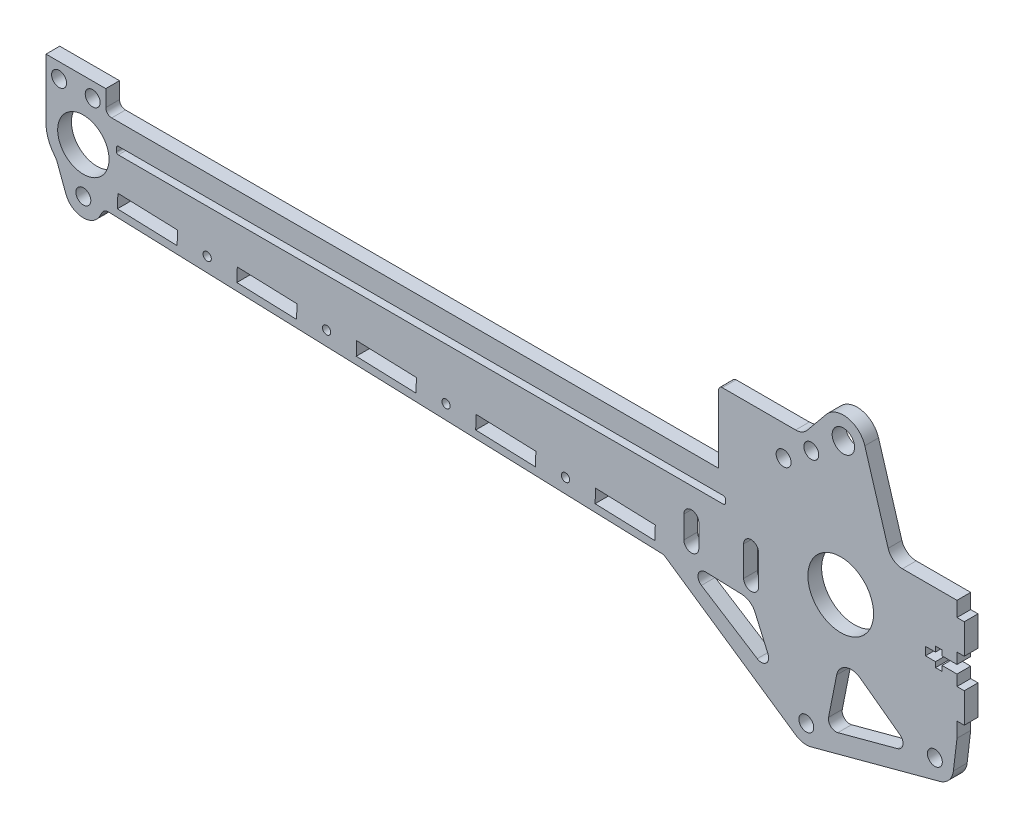
from build123d import *

# Parameters (mm, degrees)
SKETCH1_R            = 10.9125
BOSS_EXTRUDE1_DEPTH  = 5.842
SKETCH2_W            = 293.790339819
SKETCH2_H            = 3.175
CUT_EXTRUDE1_DEPTH   = 183.648332583
FILLET1_R            = 0.79375
SKETCH3_R            = 13.97
CUT_EXTRUDE2_DEPTH   = 183.648332583
SKETCH5_R            = 3.175
BOSS_EXTRUDE3_DEPTH  = 5.842
FILLET2_R            = 2.54
BOSS_EXTRUDE6_START  = -5.842
SKETCH8_R            = 3.175
BOSS_EXTRUDE6_DEPTH  = 5.842
FILLET7_R            = 6.35
BOSS_EXTRUDE8_START  = -5.842
BOSS_EXTRUDE8_DEPTH  = 5.842
FILLET8_R            = 25.4
FILLET9_R            = 3.175
SKETCH11_R           = 3.175
BOSS_EXTRUDE11_DEPTH = 5.842
FILLET10_R           = 6.35
SKETCH13_R           = 1.7526
CUT_EXTRUDE4_DEPTH   = 218.952958723
BOSS_EXTRUDE13_DEPTH = 5.842
FILLET12_R           = 3.175
CUT_EXTRUDE6_DEPTH   = 218.952958723
BOSS_EXTRUDE15_START = -5.842
SKETCH18_R           = 4.7625
BOSS_EXTRUDE15_DEPTH = 5.842
FILLET14_R           = 76.2
BOSS_EXTRUDE17_DEPTH = 5.842
FILLET15_R           = 6.35
SKETCH22_W           = 34.925
SKETCH22_H           = 3.175
BOSS_EXTRUDE19_DEPTH = 5.842
FILLET17_R           = 0.79375
BOSS_EXTRUDE22_START = -5.842
BOSS_EXTRUDE22_DEPTH = 5.842
FILLET21_R           = 1.5875
FILLET22_R           = 6.35
SKETCH27_R           = 3.175
CUT_EXTRUDE8_DEPTH   = 224.524729346


with BuildPart() as part:
    # Sketch1 → Boss-Extrude1 (new body)
    with BuildSketch(Plane.XY):
        with BuildLine():
            Line((122.709551788, -20.986085355), (160.954012843, -20.59834137))
            ThreePointArc((160.954012843, -20.59834137), (181.344310544, 0.104420161), (160.745175204, 20.5994))
            Line((160.745175204, 20.5994), (-161.220164615, 20.5994))
            ThreePointArc((-161.220164615, 20.5994), (-177.092786914, 4.999147791), (-161.769577895, -11.141089909))
            Line((-161.769577895, -11.141089909), (122.425409892, -20.982607653))
            ThreePointArc((122.425409892, -20.982607653), (122.567461384, -20.985936125), (122.709551788, -20.986085355))
        make_face()
        with BuildLine():
            ThreePointArc((119.470175204, -1.936411689), (122.645175204, 1.238588311), (125.820175204, -1.936411689))
            Line((125.820175204, -1.936411689), (125.820175204, -14.636411689))
            ThreePointArc((125.820175204, -14.636411689), (122.645175204, -17.811411689), (119.470175204, -14.636411689))
            Line((119.470175204, -14.636411689), (119.470175204, -1.936411689))
        make_face(mode=Mode.SUBTRACT)
        with Locations((-161.220164615, 4.7244)):
            Circle(SKETCH1_R, mode=Mode.SUBTRACT)
        with Locations((160.745175204, 0)):
            Circle(SKETCH1_R, mode=Mode.SUBTRACT)
    extrude(amount=BOSS_EXTRUDE1_DEPTH)

    # Sketch2 → Cut-Extrude1 (cut, through all)
    with BuildSketch(Plane.XY.offset(5.842)):
        with Locations((-0.237494705, 9.9695)):
            Rectangle(SKETCH2_W, SKETCH2_H)
    extrude(amount=-CUT_EXTRUDE1_DEPTH, mode=Mode.SUBTRACT)

    # Fillet1
    fillet1_edges = [part.edges().sort_by_distance(p)[0] for p in [
        (-147.132664615, 8.382, 2.921),
        (-147.132664615, 11.557, 2.921),
        (146.657675204, 11.557, 2.921),
        (146.657675204, 8.382, 2.921),
    ]]
    fillet(fillet1_edges, radius=FILLET1_R)

    # Sketch3 → Cut-Extrude2 (cut, through all)
    with BuildSketch(Plane.XY.offset(5.842)):
        with Locations((160.745175204, 0)):
            Circle(SKETCH3_R)
    extrude(amount=-CUT_EXTRUDE2_DEPTH, mode=Mode.SUBTRACT)

    # Sketch5 → Boss-Extrude3 (add)
    with BuildSketch(Plane.XY.offset(5.842)):
        Polygon((-177.092786914, 4.999147791), (-168.768273233, 15.098190552), (-151.695164615, 20.5994), (-151.695164615, 30.1244), (-177.095164615, 30.1244), (-177.095164615, 24.527553517), align=None)
        with Locations((-171.538914615, 23.7744)):
            Circle(SKETCH5_R, mode=Mode.SUBTRACT)
        with Locations((-157.251414615, 23.7744)):
            Circle(SKETCH5_R, mode=Mode.SUBTRACT)
    extrude(amount=-BOSS_EXTRUDE3_DEPTH)

    # Fillet2
    fillet2_edges = [part.edges().sort_by_distance(p)[0] for p in [
        (-151.695164615, 20.5994, 2.921),
    ]]
    fillet(fillet2_edges, radius=FILLET2_R)

    # Sketch8 → Boss-Extrude6 (add)
    # profile 1 of 4: a face of its own
    with BuildSketch(Plane.XY.offset(5.842).offset(BOSS_EXTRUDE6_START)):
        with BuildLine():
            Line((142.738001942, 45.835451936), (146.953077204, 20.5994))
            Line((146.953077204, 20.5994), (160.745175204, 20.5994))
            ThreePointArc((160.745175204, 20.5994), (170.55729567, 18.112359656), (178.000110287, 11.251777444))
            Line((178.000110287, 11.251777444), (152.872485287, 49.785737108))
            ThreePointArc((152.872485287, 49.785737108), (146.200455582, 51.927689081), (142.738001942, 45.835451936))
        make_face()
        with Locations((148.218333561, 46.750809468)):
            Circle(SKETCH8_R, mode=Mode.SUBTRACT)
    # profile 2 of 4: a face of its own
    with BuildSketch(Plane.XY.offset(5.842).offset(BOSS_EXTRUDE6_START)):
        with BuildLine():
            Line((153.886839934, -56.197944739), (160.954012843, -20.59834137))
            Line((160.954012843, -20.59834137), (122.709551788, -20.986085355))
            Line((122.709551788, -20.986085355), (138.829185613, -57.833669946))
            ThreePointArc((138.829185613, -57.833669946), (146.95848435, -62.543443278), (153.886839934, -56.197944739))
        make_face()
        with Locations((146.101270294, -54.652366653)):
            Circle(SKETCH8_R, mode=Mode.SUBTRACT)
    # profile 3 of 4: a face of its own
    with BuildSketch(Plane.XY.offset(5.842).offset(BOSS_EXTRUDE6_START)):
        with BuildLine():
            Line((207.479456386, -35.793717173), (178.395702626, 10.620459597))
            ThreePointArc((178.395702626, 10.620459597), (178.728295444, -10.047022783), (160.954012843, -20.59834137))
            Line((160.954012843, -20.59834137), (196.051477138, -46.403405163))
            ThreePointArc((196.051477138, -46.403405163), (206.153884177, -45.825443165), (207.479456386, -35.793717173))
        make_face()
        with Locations((200.753352193, -40.008385443)):
            Circle(SKETCH8_R, mode=Mode.SUBTRACT)
    # profile 4 of 4: a face of its own
    with BuildSketch(Plane.XY.offset(5.842).offset(BOSS_EXTRUDE6_START)):
        with BuildLine():
            ThreePointArc((178.395702626, 10.620459597), (178.200760806, 10.937907095), (178.000110287, 11.251777444))
            Line((178.000110287, 11.251777444), (178.395702626, 10.620459597))
        make_face()
    extrude(amount=BOSS_EXTRUDE6_DEPTH)

    # Fillet7
    fillet7_edges = [part.edges().sort_by_distance(p)[0] for p in [
        (122.709551788, -20.986085355, 2.921),
        (160.954012843, -20.59834137, 2.921),
    ]]
    fillet(fillet7_edges, radius=FILLET7_R)

    # Sketch9 → Boss-Extrude8 (add)
    with BuildSketch(Plane.XY.offset(5.842).offset(BOSS_EXTRUDE8_START)):
        with BuildLine():
            ThreePointArc((153.844345502, -52.906316091), (152.894580547, -58.757831554), (148.155646464, -62.319402899))
            Line((148.155646464, -62.319402899), (202.807728363, -47.675421689))
            ThreePointArc((202.807728363, -47.675421689), (196.922905388, -46.960477469), (193.174627078, -42.367798905))
            Line((193.174627078, -42.367798905), (153.844345502, -52.906316091))
        make_face()
        with BuildLine():
            Line((80.616828047, -19.534799219), (141.624211884, -61.206743377))
            ThreePointArc((141.624211884, -61.206743377), (139.989396855, -59.716841879), (138.829185613, -57.833669946))
            Line((138.829185613, -57.833669946), (134.040995565, -46.888431379))
            Line((134.040995565, -46.888431379), (91.703105896, -19.918710987))
            Line((91.703105896, -19.918710987), (80.616828047, -19.534799219))
        make_face()
    extrude(amount=BOSS_EXTRUDE8_DEPTH)

    # Fillet8
    fillet8_edges = [part.edges().sort_by_distance(p)[0] for p in [
        (80.616828047, -19.534799219, 2.921),
    ]]
    fillet(fillet8_edges, radius=FILLET8_R)

    # Fillet9
    fillet9_edges = [part.edges().sort_by_distance(p)[0] for p in [
        (134.040995565, -46.888431379, 2.921),
        (91.703105896, -19.918710987, 2.921),
        (191.260301775, -42.880740824, 2.921),
        (154.579387425, -52.709362201, 2.921),
    ]]
    fillet(fillet9_edges, radius=FILLET9_R)

    # Sketch11 → Boss-Extrude11 (add)
    with BuildSketch(Plane.XY.offset(5.842)):
        with BuildLine():
            Line((-172.733097838, -6.205741518), (-150.679526029, -11.525132369))
            Line((-150.679526029, -11.525132369), (-154.239260747, -18.103282812))
            ThreePointArc((-154.239260747, -18.103282812), (-161.767394539, -22.244213872), (-168.654352653, -17.107102196))
            Line((-168.654352653, -17.107102196), (-172.733097838, -6.205741518))
        make_face()
        with Locations((-161.220164615, -14.3256)):
            Circle(SKETCH11_R, mode=Mode.SUBTRACT)
    extrude(amount=-BOSS_EXTRUDE11_DEPTH)

    # Fillet10
    fillet10_edges = [part.edges().sort_by_distance(p)[0] for p in [
        (-150.679526029, -11.525132369, 2.921),
        (-172.733097838, -6.205741518, 2.921),
    ]]
    fillet(fillet10_edges, radius=FILLET10_R)

    # Sketch13 → Cut-Extrude4 (cut, through all)
    with BuildSketch(Plane(origin=(0, 0, 0), x_dir=(-1, 0, 0), z_dir=(0, 0, -1))):
        with Locations((108.569247603, -10.060637485)):
            Circle(SKETCH13_R)
        with Locations((57.799679894, -11.818759982)):
            Circle(SKETCH13_R)
        with Locations((7.030112186, -13.576882478)):
            Circle(SKETCH13_R)
        with Locations((-43.739455522, -15.335004975)):
            Circle(SKETCH13_R)
        Polygon((146.54533134, -5.822795469), (146.747515427, -11.661295756), (121.362731573, -12.540357004), (121.160547486, -6.701856718), align=None)
        Polygon((95.775763632, -7.580917966), (70.390979778, -8.459979214), (70.593163865, -14.298479501), (95.977947719, -13.419418252), align=None)
        Polygon((45.006195924, -9.339040463), (19.62141207, -10.218101711), (19.823596157, -16.056601997), (45.208380011, -15.177540749), align=None)
        Polygon((-5.763371785, -11.097162959), (-31.148155639, -11.976224208), (-30.945971552, -17.814724494), (-5.561187697, -16.935663246), align=None)
        Polygon((-56.532939493, -12.855285456), (-81.917723347, -13.734346704), (-81.71553926, -19.572846991), (-56.330755406, -18.693785742), align=None)
    extrude(amount=-CUT_EXTRUDE4_DEPTH, mode=Mode.SUBTRACT)

    # Sketch14 → Boss-Extrude13 (add)
    with BuildSketch(Plane(origin=(0, 0, 0), x_dir=(-1, 0, 0), z_dir=(0, 0, -1))):
        with BuildLine():
            Line((-73.253336961, -19.279805531), (146.747515427, -11.661295756))
            ThreePointArc((146.747515427, -11.661295756), (149.950056378, -12.401642142), (152.353365005, -14.644071394))
            Line((152.353365005, -14.644071394), (-85.432809944, -22.87847721))
            ThreePointArc((-85.432809944, -22.87847721), (-79.57161907, -20.305643419), (-73.253336961, -19.279805531))
        make_face()
    extrude(amount=-BOSS_EXTRUDE13_DEPTH)

    # Fillet12
    fillet12_edges = [part.edges().sort_by_distance(p)[0] for p in [
        (-152.353365005, -14.644071394, 2.921),
        (85.432809944, -22.87847721, 2.921),
    ]]
    fillet(fillet12_edges, radius=FILLET12_R)

    # Sketch17 → Cut-Extrude6 (cut, through all)
    with BuildSketch(Plane.XY.offset(5.842)):
        with BuildLine():
            Line((94.070175204, -13.157241094), (94.070175204, -3.632241094))
            ThreePointArc((94.070175204, -3.632241094), (97.245175204, -0.457241094), (100.420175204, -3.632241094))
            Line((100.420175204, -3.632241094), (100.420175204, -13.157241094))
            ThreePointArc((100.420175204, -13.157241094), (97.245175204, -16.332241094), (94.070175204, -13.157241094))
        make_face()
    extrude(amount=-CUT_EXTRUDE6_DEPTH, mode=Mode.SUBTRACT)

    # Sketch18 → Boss-Extrude15 (add)
    with BuildSketch(Plane.XY.offset(5.842).offset(BOSS_EXTRUDE15_START)):
        with BuildLine():
            Line((178.000110287, 11.251777444), (152.872485287, 49.785737108))
            ThreePointArc((152.872485287, 49.785737108), (148.515134048, 52.299126648), (143.914515362, 50.264932826))
            Line((143.914515362, 50.264932826), (154.487525506, 63.213912939))
            ThreePointArc((154.487525506, 63.213912939), (163.71491015, 66.533432279), (170.982028148, 59.949145528))
            Line((170.982028148, 59.949145528), (192.937579506, -12.586628788))
            Line((192.937579506, -12.586628788), (178.000110287, 11.251777444))
        make_face()
        with Locations((161.865499561, 57.189701468)):
            Circle(SKETCH18_R, mode=Mode.SUBTRACT)
    extrude(amount=BOSS_EXTRUDE15_DEPTH)

    # Fillet14
    fillet14_edges = [part.edges().sort_by_distance(p)[0] for p in [
        (192.937579506, -12.586628788, 2.921),
    ]]
    fillet(fillet14_edges, radius=FILLET14_R)

    # Sketch20 → Boss-Extrude17 (add)
    with BuildSketch(Plane.XY.offset(5.842)):
        with BuildLine():
            Line((213.256475204, 3.6195), (210.157675204, 3.6195))
            Line((210.157675204, 3.6195), (210.157675204, -0.9779))
            Line((210.157675204, -0.9779), (203.807675204, -0.9779))
            Line((203.807675204, -0.9779), (203.807675204, 1.23825))
            Line((203.807675204, 1.23825), (201.029550204, 1.23825))
            Line((201.029550204, 1.23825), (201.029550204, -0.9779))
            Line((201.029550204, -0.9779), (196.749675204, -0.9779))
            Line((196.749675204, -0.9779), (196.749675204, -4.4831))
            Line((196.749675204, -4.4831), (201.029550204, -4.4831))
            Line((201.029550204, -4.4831), (201.029550204, -6.69925))
            Line((201.029550204, -6.69925), (203.807675204, -6.69925))
            Line((203.807675204, -6.69925), (203.807675204, -4.4831))
            Line((203.807675204, -4.4831), (210.157675204, -4.4831))
            Line((210.157675204, -4.4831), (210.157675204, -9.0805))
            Line((210.157675204, -9.0805), (213.256475204, -9.0805))
            Line((213.256475204, -9.0805), (213.256475204, -21.7805))
            Line((213.256475204, -21.7805), (210.157675204, -21.7805))
            Line((210.157675204, -21.7805), (210.157675204, -28.1305))
            Line((210.157675204, -28.1305), (208.635431703, -40.94472344))
            ThreePointArc((208.635431703, -40.94472344), (208.498219795, -38.270302569), (207.479456386, -35.793717173))
            Line((207.479456386, -35.793717173), (198.347524409, -21.220250882))
            ThreePointArc((198.347524409, -21.220250882), (193.55486735, -12.305885912), (189.985895971, -2.83498797))
            Line((189.985895971, -2.83498797), (182.266048754, 22.6695))
            Line((182.266048754, 22.6695), (210.157675204, 22.6695))
            Line((210.157675204, 22.6695), (210.157675204, 16.3195))
            Line((210.157675204, 16.3195), (213.256475204, 16.3195))
            Line((213.256475204, 16.3195), (213.256475204, 3.6195))
        make_face()
    extrude(amount=-BOSS_EXTRUDE17_DEPTH)

    # Fillet15
    fillet15_edges = [part.edges().sort_by_distance(p)[0] for p in [
        (182.266048754, 22.6695, 2.921),
    ]]
    fillet(fillet15_edges, radius=FILLET15_R)

    # Sketch22 → Boss-Extrude19 (add)
    with BuildSketch(Plane.XY.offset(5.842)):
        with Locations((129.195175204, 9.9695)):
            Rectangle(SKETCH22_W, SKETCH22_H)
    extrude(amount=-BOSS_EXTRUDE19_DEPTH)

    # Fillet17
    fillet17_edges = [part.edges().sort_by_distance(p)[0] for p in [
        (111.732675204, 11.557, 2.921),
        (111.732675204, 8.382, 2.921),
    ]]
    fillet(fillet17_edges, radius=FILLET17_R)

    # Sketch25 → Boss-Extrude22 (add)
    with BuildSketch(Plane.XY.offset(5.842).offset(BOSS_EXTRUDE22_START)):
        with BuildLine():
            Line((108.853077204, 20.5994), (142.662083561, 20.5994))
            Line((142.662083561, 20.5994), (146.953077204, 20.5994))
            Line((146.953077204, 20.5994), (142.738001942, 45.835451936))
            ThreePointArc((142.738001942, 45.835451936), (142.848280288, 48.177148106), (143.914515362, 50.264932826))
            Line((143.914515362, 50.264932826), (144.579538369, 51.0794))
            Line((144.579538369, 51.0794), (142.662083561, 51.0794))
            Line((142.662083561, 51.0794), (108.853077204, 51.0794))
            Line((108.853077204, 51.0794), (108.853077204, 20.5994))
        make_face()
    extrude(amount=BOSS_EXTRUDE22_DEPTH)

    # Fillet21
    fillet21_edges = [part.edges().sort_by_distance(p)[0] for p in [
        (108.853077204, 51.0794, 2.921),
    ]]
    fillet(fillet21_edges, radius=FILLET21_R)

    # Fillet22
    fillet22_edges = [part.edges().sort_by_distance(p)[0] for p in [
        (144.579538369, 51.0794, 2.921),
    ]]
    fillet(fillet22_edges, radius=FILLET22_R)

    # Sketch27 → Cut-Extrude8 (cut, through all)
    with BuildSketch(Plane.XY.offset(5.842)):
        with Locations((136.465499561, 38.139701468)):
            Circle(SKETCH27_R)
    extrude(amount=-CUT_EXTRUDE8_DEPTH, mode=Mode.SUBTRACT)


solid = part.part
